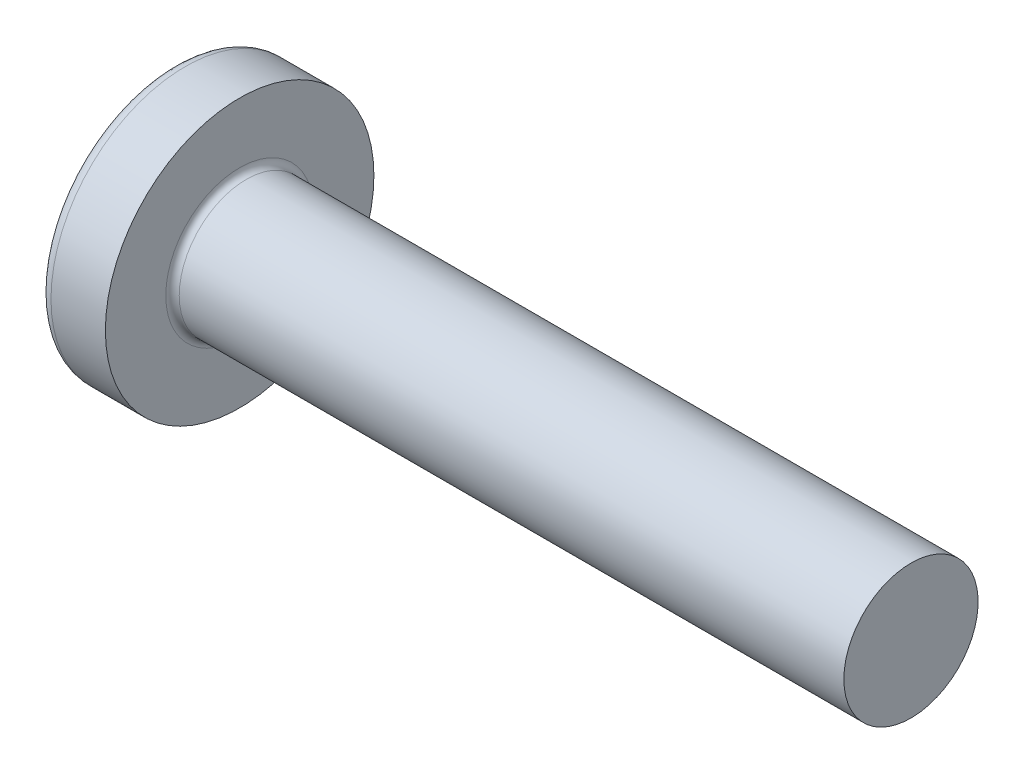
from build123d import *

# Parameters (mm, degrees)
FILLET1_R    = 0.1
RECPAT_COUNT = 2
RECPAT_ANGLE = 90


with BuildPart() as part:
    # BodySke → Base-Revolve (revolve)
    with BuildSketch(Plane.XY, mode=Mode.PRIVATE) as base_revolve_sk:
        with BuildLine():
            Line((1.6, 1), (1.6, 2))
            Line((1.6, 2), (0.790020747, 2))
            ThreePointArc((0.790020747, 2), (0.709789294, 1.981130115), (0.646379599, 1.928476821))
            ThreePointArc((0.646379599, 1.928476821), (0.165895084, 1.016959861), (0, 0))
            Line((0, 0), (11.6, 0))
            Line((11.6, 0), (11.6, 1))
            Line((11.6, 1), (1.6, 1))
        make_face()
    revolve(base_revolve_sk.sketch.rotate(Axis((0.790020747, 0, 0), (1, 0, 0)), 90), axis=Axis((0.790020747, 0, 0), (1, 0, 0)))

    # Fillet1
    fillet1_edges = [part.edges().sort_by_distance(p)[0] for p in [
        (1.6, 0, -1),
    ]]
    fillet(fillet1_edges, radius=FILLET1_R)

    # Sketch3 → Recess section 0
    with BuildSketch(Plane(origin=(0, 0, 0), x_dir=(0, 0, -1), z_dir=(1, 0, 0))):
        with BuildLine():
            Line((0.24, -1.05), (-0.24, -1.05))
            Line((-0.24, -1.05), (-0.24, 1.05))
            Line((-0.24, 1.05), (0.24, 1.05))
            Line((0.24, 1.05), (0.24, -1.05))
        make_face()
    # Sketch4 → Recess section 1
    with BuildSketch(Plane(origin=(1.42, 0, 0), x_dir=(0, 0, -1), z_dir=(1, 0, 0))):
        with BuildLine():
            Line((0.24, -0.342014141), (-0.24, -0.342014141))
            Line((-0.24, -0.342014141), (-0.24, 0.342014141))
            Line((-0.24, 0.342014141), (0.24, 0.342014141))
            Line((0.24, 0.342014141), (0.24, -0.342014141))
        make_face()
    recess = loft(mode=Mode.SUBTRACT)

    # RecPat: Recess ×2 about axis
    recpat_axis = Axis((0, 0, 0), (1, 0, 0))
    for i in range(1, RECPAT_COUNT):
        add(recess.rotate(recpat_axis, i * RECPAT_ANGLE / (RECPAT_COUNT - 1)), mode=Mode.SUBTRACT)

    # RecCorSke → RecessCore (revolve, cut)
    with BuildSketch(Plane.XY, mode=Mode.PRIVATE) as recesscore_sk:
        Polygon((0, 0), (0, 0.454796073), (1.42, 0.3555), (1.535508952, 0), align=None)
    revolve(recesscore_sk.sketch.rotate(Axis((-3.175, 0, 0), (1, 0, 0)), 13.894577821), axis=Axis((-3.175, 0, 0), (1, 0, 0)), mode=Mode.SUBTRACT)


solid = part.part
